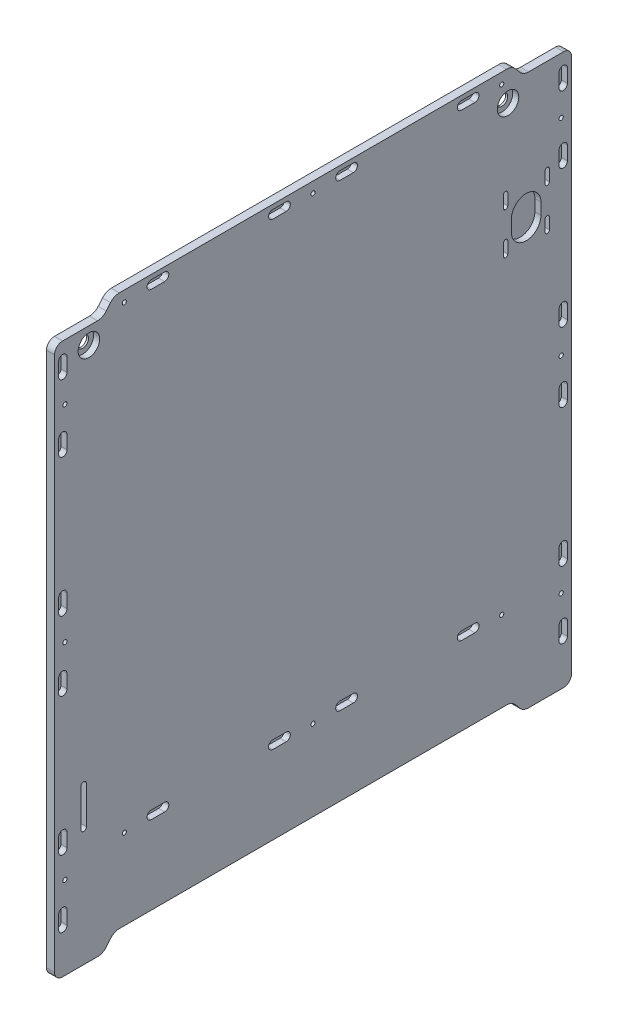
from build123d import *

# Parameters (mm, degrees)
CROQUIS1_R              = 4.25
CROQUIS1_R_2            = 1.55
CROQUIS1_R_3            = 1.6
SALIENTE_EXTRUIR1_DEPTH = 6
CROQUIS3_R              = 8
CORTAR_EXTRUIR1_DEPTH   = 4.5
CHAFL_N1_SIZE           = 1.5
CORTAR_EXTRUIR2_DEPTH   = 6


with BuildPart() as part:
    # Croquis1 → Saliente-Extruir1 (new body)
    with BuildSketch(Plane(origin=(0, 0, 0), x_dir=(0, 0, -1), z_dir=(1, 0, 0))):
        with BuildLine():
            Line((138.549019323, -203.054493985), (135.2532588, -199.126759542))
            ThreePointArc((135.2532588, -199.126759542), (132.334136258, -196.886838034), (128.741881033, -196.090454224))
            Line((128.741881033, -196.090454224), (-159.54831728, -196.090454224))
            ThreePointArc((-159.54831728, -196.090454224), (-163.140572505, -196.886838034), (-166.059695047, -199.126759542))
            Line((-166.059695047, -199.126759542), (-169.355455569, -203.054493985))
            ThreePointArc((-169.355455569, -203.054493985), (-172.274578058, -205.294415452), (-175.866833217, -206.090799248))
            Line((-175.866833217, -206.090799248), (-201.903218123, -206.090799248))
            ThreePointArc((-201.903218123, -206.090799248), (-206.14585881, -204.333439935), (-207.903218123, -200.090799248))
            Line((-207.903218123, -200.090799248), (-207.903218123, 198.006904316))
            ThreePointArc((-207.903218123, 198.006904316), (-206.145858831, 202.249545024), (-201.903218123, 204.006904345))
            Line((-201.903218123, 204.006904345), (-175.90321816, 204.006904345))
            ThreePointArc((-175.90321816, 204.006904345), (-172.310962954, 204.803288151), (-169.391840427, 207.043209647))
            Line((-169.391840427, 207.043209647), (-166.178352412, 210.872895533))
            ThreePointArc((-166.178352412, 210.872895533), (-163.259229966, 213.112816968), (-159.666974858, 213.909200752))
            Line((-159.666974858, 213.909200752), (128.860538611, 213.909200752))
            ThreePointArc((128.860538611, 213.909200752), (132.452793719, 213.112816968), (135.371916166, 210.872895533))
            Line((135.371916166, 210.872895533), (138.585404181, 207.043209647))
            ThreePointArc((138.585404181, 207.043209647), (141.504526707, 204.803288151), (145.096781914, 204.006904345))
            Line((145.096781914, 204.006904345), (171.096781877, 204.006904345))
            ThreePointArc((171.096781877, 204.006904345), (175.339422584, 202.249545024), (177.096781877, 198.006904316))
            Line((177.096781877, 198.006904316), (177.096781877, -200.090799248))
            ThreePointArc((177.096781877, -200.090799248), (175.339422564, -204.333439935), (171.096781877, -206.090799248))
            Line((171.096781877, -206.090799248), (145.060396971, -206.090799248))
            ThreePointArc((145.060396971, -206.090799248), (141.468141811, -205.294415452), (138.549019323, -203.054493985))
        make_face()
        with Locations((-182.303218123, 191.506904345)):
            Circle(CROQUIS1_R, mode=Mode.SUBTRACT)
        with Locations((129.796781877, 191.506904345)):
            Circle(CROQUIS1_R, mode=Mode.SUBTRACT)
        with Locations((-15.403218123, 205.909200752)):
            Circle(CROQUIS1_R_2, mode=Mode.SUBTRACT)
        with Locations((125.096781877, 205.909200752)):
            Circle(CROQUIS1_R_2, mode=Mode.SUBTRACT)
        with Locations((-155.903218123, 205.909200752)):
            Circle(CROQUIS1_R_2, mode=Mode.SUBTRACT)
        with Locations((-15.403218123, -136.090799248)):
            Circle(CROQUIS1_R_2, mode=Mode.SUBTRACT)
        with Locations((125.096781877, -136.090799248)):
            Circle(CROQUIS1_R_2, mode=Mode.SUBTRACT)
        with Locations((-155.903218123, -136.090799248)):
            Circle(CROQUIS1_R_2, mode=Mode.SUBTRACT)
        with Locations((-200.153218123, 162.206904345)):
            Circle(CROQUIS1_R_3, mode=Mode.SUBTRACT)
        with Locations((-200.153218123, 8.909373264)):
            Circle(CROQUIS1_R_3, mode=Mode.SUBTRACT)
        with Locations(Location((-200.153218123, -144.388157817, 0), (0, 0, 180))):
            Circle(CROQUIS1_R_3, mode=Mode.SUBTRACT)
        with Locations((169.346781877, -144.388157817)):
            Circle(CROQUIS1_R_3, mode=Mode.SUBTRACT)
        with Locations(Location((169.346781877, 8.909373264, 0), (0, 0, 180))):
            Circle(CROQUIS1_R_3, mode=Mode.SUBTRACT)
        with Locations(Location((169.346781877, 162.206904345, 0), (0, 0, 180))):
            Circle(CROQUIS1_R_3, mode=Mode.SUBTRACT)
        with BuildLine():
            Line((126.396781877, 133.909200752), (126.396781877, 125.409200752))
            ThreePointArc((126.396781877, 125.409200752), (127.996781877, 123.809200752), (129.596781877, 125.409200752))
            Line((129.596781877, 125.409200752), (129.596781877, 133.909200752))
            ThreePointArc((129.596781877, 133.909200752), (127.996781877, 135.509200752), (126.396781877, 133.909200752))
        make_face(mode=Mode.SUBTRACT)
        with BuildLine():
            Line((157.396781877, 133.909200752), (157.396781877, 125.409200752))
            ThreePointArc((157.396781877, 125.409200752), (158.996781877, 123.809200752), (160.596781877, 125.409200752))
            Line((160.596781877, 125.409200752), (160.596781877, 133.909200752))
            ThreePointArc((160.596781877, 133.909200752), (158.996781877, 135.509200752), (157.396781877, 133.909200752))
        make_face(mode=Mode.SUBTRACT)
        with BuildLine():
            Line((157.396781877, 102.909200752), (157.396781877, 94.409200752))
            ThreePointArc((157.396781877, 94.409200752), (158.996781877, 92.809200752), (160.596781877, 94.409200752))
            Line((160.596781877, 94.409200752), (160.596781877, 102.909200752))
            ThreePointArc((160.596781877, 102.909200752), (158.996781877, 104.509200752), (157.396781877, 102.909200752))
        make_face(mode=Mode.SUBTRACT)
        with BuildLine():
            Line((126.396781877, 102.909200752), (126.396781877, 94.409200752))
            ThreePointArc((126.396781877, 94.409200752), (127.996781877, 92.809200752), (129.596781877, 94.409200752))
            Line((129.596781877, 94.409200752), (129.596781877, 102.909200752))
            ThreePointArc((129.596781877, 102.909200752), (127.996781877, 104.509200752), (126.396781877, 102.909200752))
        make_face(mode=Mode.SUBTRACT)
    extrude(amount=SALIENTE_EXTRUIR1_DEPTH)

    # Croquis3 → Cortar-Extruir1 (cut)
    with BuildSketch(Plane(origin=(6, 0, 0), x_dir=(0, 0, -1), z_dir=(1, 0, 0))):
        with Locations((-182.303218123, 191.506904345)):
            Circle(CROQUIS3_R)
        with Locations((129.796781877, 191.506904345)):
            Circle(CROQUIS3_R)
        with BuildLine():
            Line((132.296781877, 115.506904345), (132.296781877, 107.006904345))
            ThreePointArc((132.296781877, 107.006904345), (143.296781877, 96.006904345), (154.296781877, 107.006904345))
            Line((154.296781877, 107.006904345), (154.296781877, 115.506904345))
            ThreePointArc((154.296781877, 115.506904345), (143.296781877, 126.506904345), (132.296781877, 115.506904345))
        make_face()
        with BuildLine():
            Line((-198.603218123, 192.206904345), (-198.603218123, 182.206904345))
            ThreePointArc((-198.603218123, 182.206904345), (-201.703218123, 179.106904345), (-204.803218123, 182.206904345))
            Line((-204.803218123, 182.206904345), (-204.803218123, 192.206904345))
            ThreePointArc((-204.803218123, 192.206904345), (-201.703218123, 195.306904345), (-198.603218123, 192.206904345))
        make_face()
        with BuildLine():
            Line((-198.603218123, 142.206904345), (-198.603218123, 132.206904345))
            ThreePointArc((-198.603218123, 132.206904345), (-201.703218123, 129.106904345), (-204.803218123, 132.206904345))
            Line((-204.803218123, 132.206904345), (-204.803218123, 142.206904345))
            ThreePointArc((-204.803218123, 142.206904345), (-201.703218123, 145.306904345), (-198.603218123, 142.206904345))
        make_face()
        with BuildLine():
            Line((-198.603218123, -124.388157817), (-198.603218123, -114.388157817))
            ThreePointArc((-198.603218123, -114.388157817), (-201.703218123, -111.288157817), (-204.803218123, -114.388157817))
            Line((-204.803218123, -114.388157817), (-204.803218123, -124.388157817))
            ThreePointArc((-204.803218123, -124.388157817), (-201.703218123, -127.488157817), (-198.603218123, -124.388157817))
        make_face()
        with BuildLine():
            Line((-204.803218123, -174.388157817), (-204.803218123, -164.388157817))
            ThreePointArc((-204.803218123, -164.388157817), (-201.703218123, -161.288157817), (-198.603218123, -164.388157817))
            Line((-198.603218123, -164.388157817), (-198.603218123, -174.388157817))
            ThreePointArc((-198.603218123, -174.388157817), (-201.703218123, -177.488157817), (-204.803218123, -174.388157817))
        make_face()
        with BuildLine():
            Line((-198.603218123, 39.767139749), (-198.603218123, 29.767139749))
            ThreePointArc((-198.603218123, 29.767139749), (-201.703218123, 26.667139749), (-204.803218123, 29.767139749))
            Line((-204.803218123, 29.767139749), (-204.803218123, 39.767139749))
            ThreePointArc((-204.803218123, 39.767139749), (-201.703218123, 42.867139749), (-198.603218123, 39.767139749))
        make_face()
        with BuildLine():
            Line((-198.603218123, -11.94839322), (-198.603218123, -21.94839322))
            ThreePointArc((-198.603218123, -21.94839322), (-201.703218123, -25.04839322), (-204.803218123, -21.94839322))
            Line((-204.803218123, -21.94839322), (-204.803218123, -11.94839322))
            ThreePointArc((-204.803218123, -11.94839322), (-201.703218123, -8.84839322), (-198.603218123, -11.94839322))
        make_face()
        with BuildLine():
            Line((167.796781877, -174.388157817), (167.796781877, -164.388157817))
            ThreePointArc((167.796781877, -164.388157817), (170.896781877, -161.288157817), (173.996781877, -164.388157817))
            Line((173.996781877, -164.388157817), (173.996781877, -174.388157817))
            ThreePointArc((173.996781877, -174.388157817), (170.896781877, -177.488157817), (167.796781877, -174.388157817))
        make_face()
        with BuildLine():
            Line((173.996781877, -124.388157817), (173.996781877, -114.388157817))
            ThreePointArc((173.996781877, -114.388157817), (170.896781877, -111.288157817), (167.796781877, -114.388157817))
            Line((167.796781877, -114.388157817), (167.796781877, -124.388157817))
            ThreePointArc((167.796781877, -124.388157817), (170.896781877, -127.488157817), (173.996781877, -124.388157817))
        make_face()
        with BuildLine():
            Line((173.996781877, -11.94839322), (173.996781877, -21.94839322))
            ThreePointArc((173.996781877, -21.94839322), (170.896781877, -25.04839322), (167.796781877, -21.94839322))
            Line((167.796781877, -21.94839322), (167.796781877, -11.94839322))
            ThreePointArc((167.796781877, -11.94839322), (170.896781877, -8.84839322), (173.996781877, -11.94839322))
        make_face()
        with BuildLine():
            Line((173.996781877, 39.767139749), (173.996781877, 29.767139749))
            ThreePointArc((173.996781877, 29.767139749), (170.896781877, 26.667139749), (167.796781877, 29.767139749))
            Line((167.796781877, 29.767139749), (167.796781877, 39.767139749))
            ThreePointArc((167.796781877, 39.767139749), (170.896781877, 42.867139749), (173.996781877, 39.767139749))
        make_face()
        with BuildLine():
            Line((-45.403218123, 210.509200752), (-35.403218123, 210.509200752))
            ThreePointArc((-35.403218123, 210.509200752), (-32.303218123, 207.409200752), (-35.403218123, 204.309200752))
            Line((-35.403218123, 204.309200752), (-45.403218123, 204.309200752))
            ThreePointArc((-45.403218123, 204.309200752), (-48.503218123, 207.409200752), (-45.403218123, 210.509200752))
        make_face()
        with BuildLine():
            Line((-135.903218123, 210.509200752), (-125.903218123, 210.509200752))
            ThreePointArc((-125.903218123, 210.509200752), (-122.803218123, 207.409200752), (-125.903218123, 204.309200752))
            Line((-125.903218123, 204.309200752), (-135.903218123, 204.309200752))
            ThreePointArc((-135.903218123, 204.309200752), (-139.003218123, 207.409200752), (-135.903218123, 210.509200752))
        make_face()
        with BuildLine():
            Line((105.096781877, 204.309200752), (95.096781877, 204.309200752))
            ThreePointArc((95.096781877, 204.309200752), (91.996781877, 207.409200752), (95.096781877, 210.509200752))
            Line((95.096781877, 210.509200752), (105.096781877, 210.509200752))
            ThreePointArc((105.096781877, 210.509200752), (108.196781877, 207.409200752), (105.096781877, 204.309200752))
        make_face()
        with BuildLine():
            Line((14.596781877, 204.309200752), (4.596781877, 204.309200752))
            ThreePointArc((4.596781877, 204.309200752), (1.496781877, 207.409200752), (4.596781877, 210.509200752))
            Line((4.596781877, 210.509200752), (14.596781877, 210.509200752))
            ThreePointArc((14.596781877, 210.509200752), (17.696781877, 207.409200752), (14.596781877, 204.309200752))
        make_face()
        with BuildLine():
            Line((-135.903218123, -131.490799248), (-125.903218123, -131.490799248))
            ThreePointArc((-125.903218123, -131.490799248), (-122.803218123, -134.590799248), (-125.903218123, -137.690799248))
            Line((-125.903218123, -137.690799248), (-135.903218123, -137.690799248))
            ThreePointArc((-135.903218123, -137.690799248), (-139.003218123, -134.590799248), (-135.903218123, -131.490799248))
        make_face()
        with BuildLine():
            Line((-45.403218123, -131.490799248), (-35.403218123, -131.490799248))
            ThreePointArc((-35.403218123, -131.490799248), (-32.303218123, -134.590799248), (-35.403218123, -137.690799248))
            Line((-35.403218123, -137.690799248), (-45.403218123, -137.690799248))
            ThreePointArc((-45.403218123, -137.690799248), (-48.503218123, -134.590799248), (-45.403218123, -131.490799248))
        make_face()
        with BuildLine():
            Line((14.596781877, -131.490799248), (4.596781877, -131.490799248))
            ThreePointArc((4.596781877, -131.490799248), (1.496781877, -134.590799248), (4.596781877, -137.690799248))
            Line((4.596781877, -137.690799248), (14.596781877, -137.690799248))
            ThreePointArc((14.596781877, -137.690799248), (17.696781877, -134.590799248), (14.596781877, -131.490799248))
        make_face()
        with BuildLine():
            Line((105.096781877, -131.490799248), (95.096781877, -131.490799248))
            ThreePointArc((95.096781877, -131.490799248), (91.996781877, -134.590799248), (95.096781877, -137.690799248))
            Line((95.096781877, -137.690799248), (105.096781877, -137.690799248))
            ThreePointArc((105.096781877, -137.690799248), (108.196781877, -134.590799248), (105.096781877, -131.490799248))
        make_face()
        with BuildLine():
            Line((173.996781877, 142.206904345), (173.996781877, 132.206904345))
            ThreePointArc((173.996781877, 132.206904345), (170.896781877, 129.106904345), (167.796781877, 132.206904345))
            Line((167.796781877, 132.206904345), (167.796781877, 142.206904345))
            ThreePointArc((167.796781877, 142.206904345), (170.896781877, 145.306904345), (173.996781877, 142.206904345))
        make_face()
        with BuildLine():
            Line((173.996781877, 192.206904345), (173.996781877, 182.206904345))
            ThreePointArc((173.996781877, 182.206904345), (170.896781877, 179.106904345), (167.796781877, 182.206904345))
            Line((167.796781877, 182.206904345), (167.796781877, 192.206904345))
            ThreePointArc((167.796781877, 192.206904345), (170.896781877, 195.306904345), (173.996781877, 192.206904345))
        make_face()
    extrude(amount=-CORTAR_EXTRUIR1_DEPTH, mode=Mode.SUBTRACT)

    # Chaflán1
    chafl_n1_edges = [part.edges().sort_by_distance(p)[0] for p in [
        (0, 205.909200752, -123.546781877),
        (0, 205.909200752, 157.453218123),
        (0, -136.090799248, 16.953218123),
        (0, -136.090799248, -123.546781877),
        (0, -136.090799248, 157.453218123),
        (0, 162.206904345, 201.753218123),
        (0, 8.909373264, 201.753218123),
        (0, -144.388157817, 198.553218123),
        (0, -144.388157817, -167.746781877),
        (0, 8.909373264, -170.946781877),
        (0, 162.206904345, -170.946781877),
        (0, 205.909200752, 16.953218123),
    ]]
    chamfer(chafl_n1_edges, length=CHAFL_N1_SIZE)

    # Croquis4 → Cortar-Extruir2 (cut)
    with BuildSketch(Plane.ZY):
        with BuildLine():
            Line((184.156655118, -118.090799248), (184.156655118, -90.056181538))
            ThreePointArc((184.156655118, -90.056181538), (186.200240965, -88.012595692), (188.243826812, -90.056181538))
            Line((188.243826812, -90.056181538), (188.243826812, -118.090799248))
            ThreePointArc((188.243826812, -118.090799248), (186.200240965, -120.134385094), (184.156655118, -118.090799248))
        make_face()
    extrude(amount=-CORTAR_EXTRUIR2_DEPTH, mode=Mode.SUBTRACT)


solid = part.part
